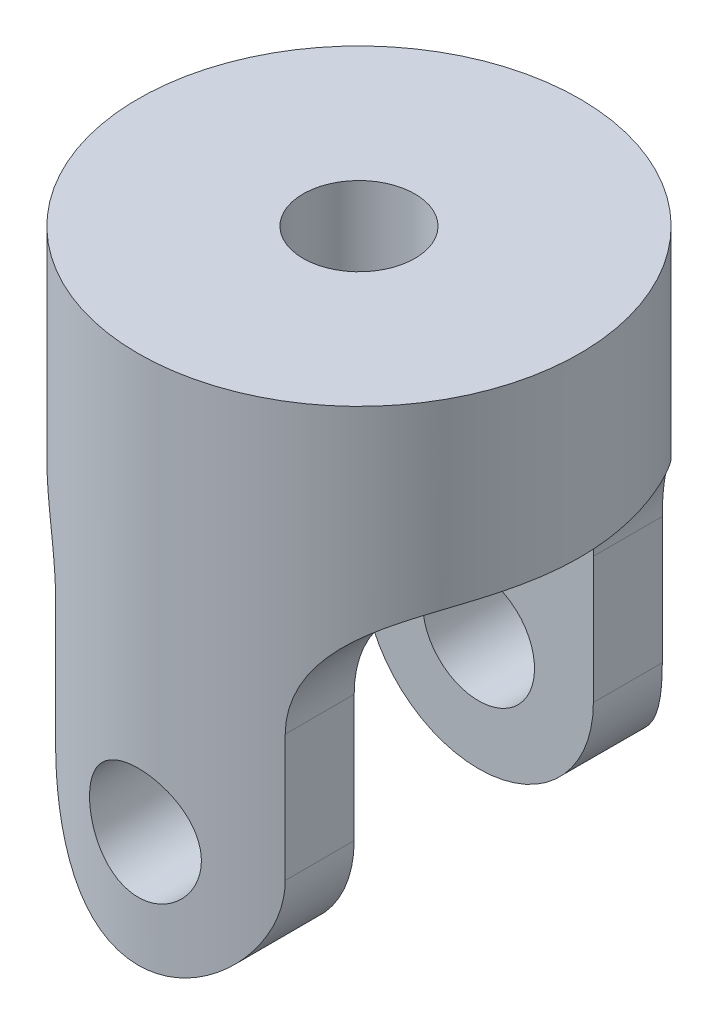
from build123d import *

# Parameters (mm, degrees)
SKETCH1_R               = 18.75
BASE_EXTRUDE_DEPTH      = 45
CUT_EXTRUDE1_DEPTH      = 53.231456039
CUT_EXTRUDE1_DEPTH_BACK = 53.231456039
CUT_EXTRUDE5_DEPTH      = 53.231456197
CUT_EXTRUDE5_DEPTH_BACK = 53.231456197
CUT_EXTRUDE6_DEPTH      = 53.231456197
CUT_EXTRUDE6_DEPTH_BACK = 53.231456197
SKETCH11_R              = 4.75
SKETCH12_R              = 4.75
CUT_EXTRUDE7_DEPTH      = 53.231456198


with BuildPart() as part:
    # Sketch1 → Base-Extrude (new body)
    with BuildSketch(Plane(origin=(0, 0, 0), x_dir=(-1, 0, 0), z_dir=(0, 1, 0))):
        Circle(SKETCH1_R)
    extrude(amount=BASE_EXTRUDE_DEPTH)

    # Sketch2 → Cut-Extrude1 (cut, two sides: drawn at the far end of the back side and taken through both)
    with BuildSketch(Plane.XY.offset(-CUT_EXTRUDE1_DEPTH_BACK)):
        with BuildLine():
            Line((-18.75, -127.153745139), (-18.75, 0))
            Line((-18.75, 0), (-18.75, 30))
            ThreePointArc((-18.75, 30), (-12.357975624, 27.051515435), (-9.75, 20.513167019))
            Line((-9.75, 20.513167019), (-9.75, 9.75))
            ThreePointArc((-9.75, 9.75), (0, 0), (9.75, 9.75))
            Line((9.75, 9.75), (9.75, 20.513167019))
            ThreePointArc((9.75, 20.513167019), (12.357975624, 27.051515435), (18.75, 30))
            Line((18.75, 30), (18.75, 0))
            Line((18.75, 0), (18.75, -127.153745139))
            Line((18.75, -127.153745139), (18.75, -381.461235416))
            Line((18.75, -381.461235416), (-18.75, -381.461235416))
            Line((-18.75, -381.461235416), (-18.75, -127.153745139))
        make_face()
    extrude(amount=CUT_EXTRUDE1_DEPTH + CUT_EXTRUDE1_DEPTH_BACK, mode=Mode.SUBTRACT)

    # Sketch8 → Cut-Extrude5 (cut, two sides: drawn at the far end of the back side and taken through both)
    with BuildSketch(Plane(origin=(0, 0, 0), x_dir=(0, 0, -1), z_dir=(1, 0, 0)).offset(-CUT_EXTRUDE5_DEPTH_BACK)):
        Polygon((-10.16, -116.972671553), (-10.16, 0), (-10.16, 29.145238826), (10.16, 29.145238826), (10.16, 0), (10.16, -116.972671553), (10.16, -350.918014658), (-10.16, -350.918014658), align=None)
    extrude(amount=CUT_EXTRUDE5_DEPTH + CUT_EXTRUDE5_DEPTH_BACK, mode=Mode.SUBTRACT)

    # Sketch11 → Cut-Extrude6 (cut, two sides: drawn at the far end of the back side and taken through both)
    with BuildSketch(Plane.XY.offset(-CUT_EXTRUDE6_DEPTH_BACK)):
        with Locations((0, 9.75)):
            Circle(SKETCH11_R)
    extrude(amount=CUT_EXTRUDE6_DEPTH + CUT_EXTRUDE6_DEPTH_BACK, mode=Mode.SUBTRACT)

    # Sketch12 → Cut-Extrude7 (cut, through all)
    with BuildSketch(Plane(origin=(0, 45, 0), x_dir=(-1, 0, 0), z_dir=(0, 1, 0))):
        Circle(SKETCH12_R)
    extrude(amount=-CUT_EXTRUDE7_DEPTH, mode=Mode.SUBTRACT)


solid = part.part
